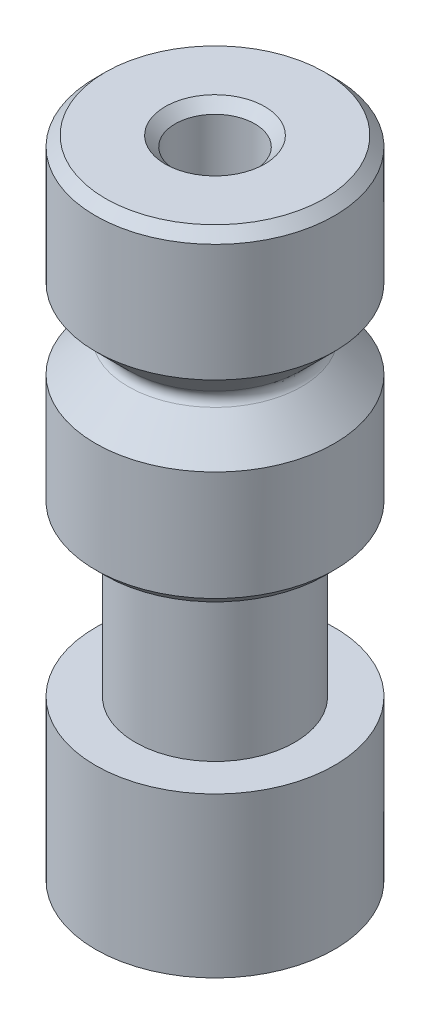
from build123d import *

# Parameters (mm, degrees)
CHAMFER1_SIZE = 0.25
CHAMFER3_SIZE = 0.5
CHAMFER4_SIZE = 0.25
FILLET1_R     = 0.25


with BuildPart() as part:
    # Sketch1 → Revolve1 (revolve)
    with BuildSketch(Plane.XY, mode=Mode.PRIVATE) as revolve1_sk:
        Polygon((-1, 4.2), (-3, 4.2), (-3, 1), (-2, 0), (-3, -1), (-3, -4), (-2, -4), (-2, -8), (-3, -8), (-3, -12), (-2, -12), (-2, -13), (-1, -13), align=None)
    revolve(revolve1_sk.sketch.rotate(Axis((0, 54.199953661, 0), (0, -1, 0)), 270), axis=Axis((0, 54.199953661, 0), (0, -1, 0)))

    # Chamfer1
    chamfer1_edges = [part.edges().sort_by_distance(p)[0] for p in [
        (0, 4.2, -1),
    ]]
    chamfer(chamfer1_edges, length=CHAMFER1_SIZE)

    # Chamfer3
    chamfer3_edges = [part.edges().sort_by_distance(p)[0] for p in [
        (0, -13, -2),
    ]]
    chamfer(chamfer3_edges, length=CHAMFER3_SIZE)

    # Chamfer4
    chamfer4_edges = [part.edges().sort_by_distance(p)[0] for p in [
        (0, -4, -3),
        (0, 4.2, -3),
    ]]
    chamfer(chamfer4_edges, length=CHAMFER4_SIZE)

    # Fillet1
    fillet1_edges = [part.edges().sort_by_distance(p)[0] for p in [
        (0, 0, -2),
    ]]
    fillet(fillet1_edges, radius=FILLET1_R)


solid = part.part
